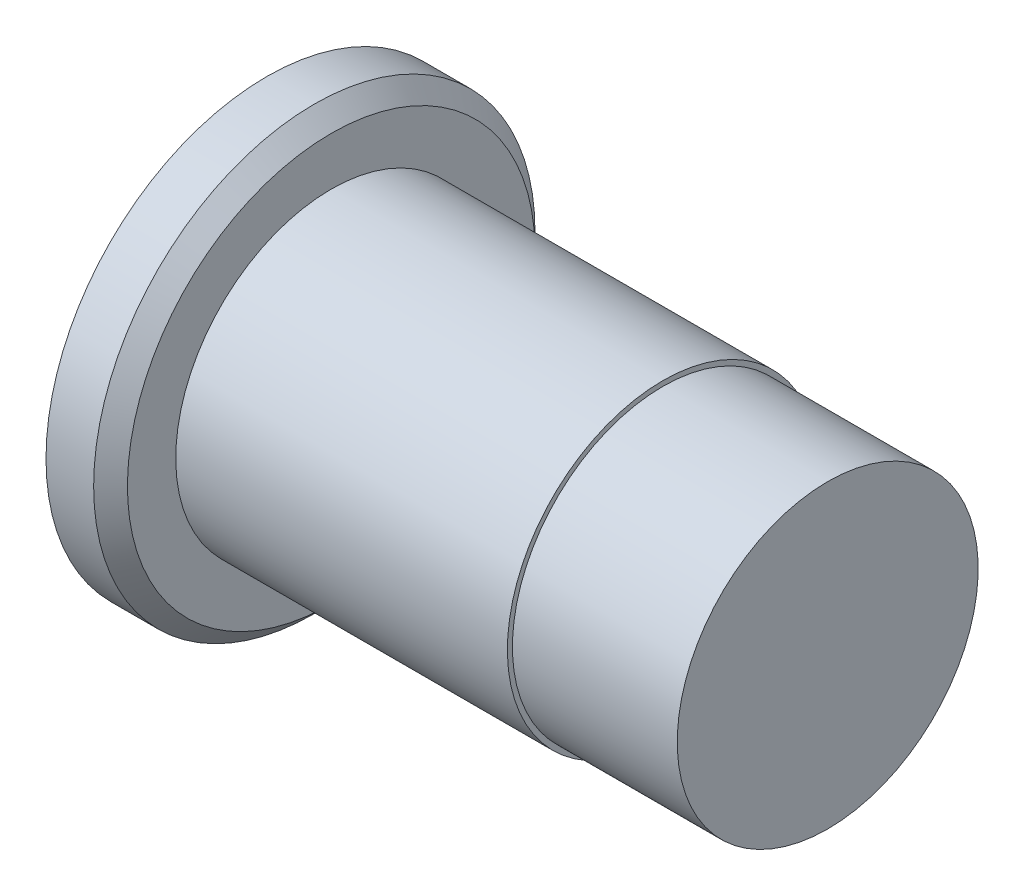
from build123d import *

# Parameters (mm, degrees)
SKETCH3_R           = 4
CUT_EXTRUDE5_DEPTH  = 10
CIRPATTERN1_COUNT   = 6
SKETCH4_R           = 23.5
CUT_EXTRUDE6_DEPTH  = 90
SKETCH5_W           = 16
SKETCH5_H           = 16
BOSS_EXTRUDE1_START = -16
SKETCH6_W           = 2
SKETCH6_H           = 2.4
BOSS_EXTRUDE1_DEPTH = 16
CIRPATTERN2_COUNT   = 12
SKETCH7_R           = 31
SKETCH7_R_2         = 30
CUT_EXTRUDE7_DEPTH  = 32.87


with BuildPart() as part:
    # Sketch1 → Revolve1 (revolve)
    with BuildSketch(Plane.XY):
        Polygon((0, 0), (0, 31), (7, 31), (7, 44), (16.5, 44), (19.87, 40.63), (19.87, 31), (118.87, 31), (118.87, 0), align=None)
    revolve(axis=Axis((118.87, 0, 0), (-1, 0, 0)))

    # Sketch3 → Cut-Extrude5 (cut)
    with BuildSketch(Plane.ZY.offset(-7)):
        with Locations(Location((0, 37.5, 0), (0, 0, 270))):
            Circle(SKETCH3_R)
    cut_extrude5 = extrude(amount=-CUT_EXTRUDE5_DEPTH, mode=Mode.SUBTRACT)

    # CirPattern1: Cut-Extrude5 ×6 about axis
    cirpattern1_axis = Axis((0, 0, 0), (1, 0, 0))
    for i in range(1, CIRPATTERN1_COUNT):
        add(cut_extrude5.rotate(cirpattern1_axis, i * 360 / CIRPATTERN1_COUNT), mode=Mode.SUBTRACT)

    # Sketch4 → Cut-Extrude6 (cut)
    with BuildSketch(Plane.ZY):
        with Locations(Location((0, 0, 0), (0, 0, 270))):
            Circle(SKETCH4_R)
    extrude(amount=-CUT_EXTRUDE6_DEPTH, mode=Mode.SUBTRACT)

    # Sketch5 → Revolve2 (revolve)
    with BuildSketch(Plane.XY, mode=Mode.PRIVATE) as revolve2_sk:
        with Locations((82, 18)):
            Rectangle(SKETCH5_W, SKETCH5_H)
    revolve(revolve2_sk.sketch.rotate(Axis((118.87, 0, 0), (-1, 0, 0)), 180), axis=Axis((118.87, 0, 0), (-1, 0, 0)))

    # Sketch6 → Boss-Extrude1 (add)
    with BuildSketch(Plane.ZY.offset(-74).offset(BOSS_EXTRUDE1_START)):
        with Locations((0, 9.8)):
            Rectangle(SKETCH6_W, SKETCH6_H)
    boss_extrude1 = extrude(amount=BOSS_EXTRUDE1_DEPTH)

    # CirPattern2: Boss-Extrude1 ×12 about axis
    cirpattern2_axis = Axis((0, 0, 0), (1, 0, 0))
    for i in range(1, CIRPATTERN2_COUNT):
        add(boss_extrude1.rotate(cirpattern2_axis, i * 360 / CIRPATTERN2_COUNT))

    # Sketch7 → Cut-Extrude7 (cut)
    with BuildSketch(Plane(origin=(118.87, 0, 0), x_dir=(0, 0, -1), z_dir=(1, 0, 0))):
        with Locations(Location((0, 0, 0), (0, 0, 90))):
            Circle(SKETCH7_R)
        with Locations(Location((0, 0, 0), (0, 0, 90))):
            Circle(SKETCH7_R_2, mode=Mode.SUBTRACT)
    extrude(amount=-CUT_EXTRUDE7_DEPTH, mode=Mode.SUBTRACT)


solid = part.part
